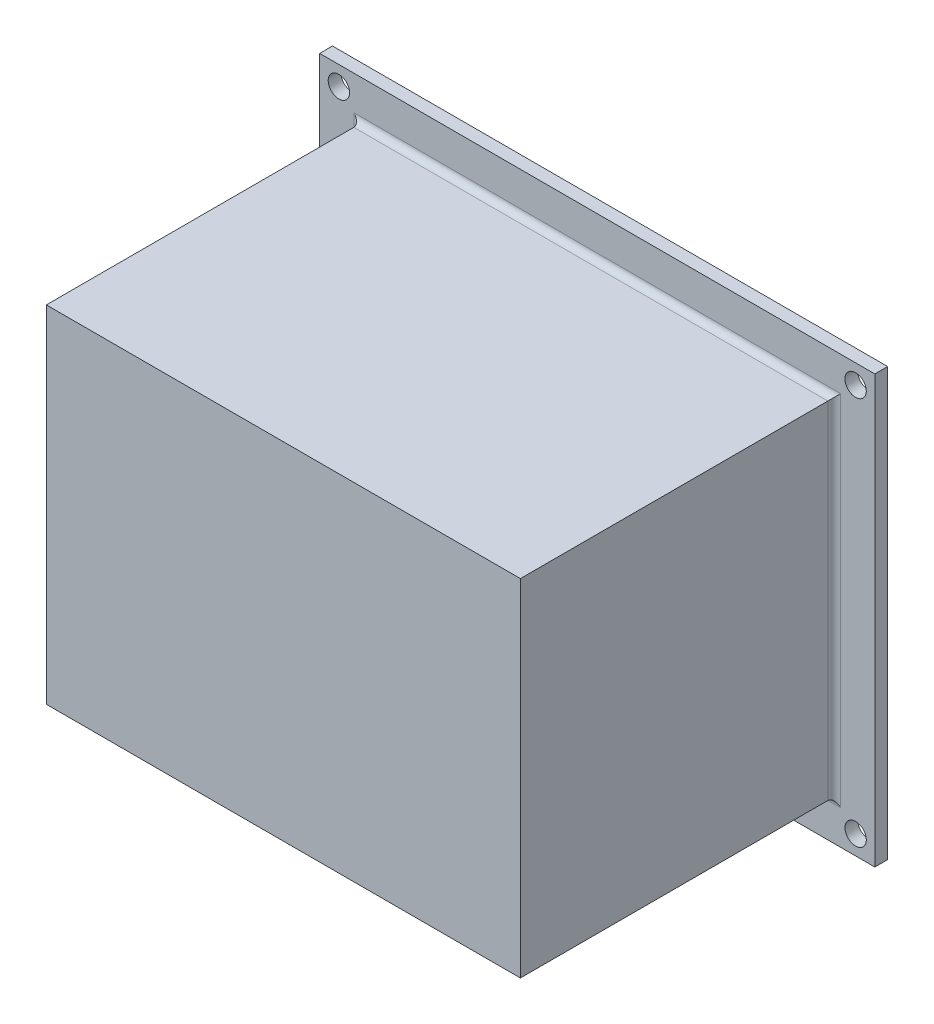
from build123d import *

# Parameters (mm, degrees)
SKETCH_1_W          = 130
SKETCH_1_H          = 100
SKETCH_1_W_2        = 105
SKETCH_1_H_2        = 75
EXTRUDE_1_DEPTH     = 3
SKETCH_2_W          = 111
SKETCH_2_H          = 81
SKETCH_2_W_2        = 105
SKETCH_2_H_2        = 75
EXTRUDE_2_DEPTH     = 73.5
FILLET_1_R          = 1.5
SKETCH_4_R          = 2.5
CUT_EXTRUDE_2_DEPTH = 113.5
CUT_EXTRUDE_4_DEPTH = 73.5
SKETCH_7_W          = 105
SKETCH_7_H          = 75
EXTRUDE_3_DEPTH     = 2.5


with BuildPart() as part:
    # 草图1 → 凸台-拉伸1 (new body)
    with BuildSketch(Plane.XY):
        Rectangle(SKETCH_1_W, SKETCH_1_H)
        Rectangle(SKETCH_1_W_2, SKETCH_1_H_2, mode=Mode.SUBTRACT)
    extrude(amount=EXTRUDE_1_DEPTH)

    # 草图2 → 凸台-拉伸2 (add)
    with BuildSketch(Plane.XY.offset(3)):
        Rectangle(SKETCH_2_W, SKETCH_2_H)
        Rectangle(SKETCH_2_W_2, SKETCH_2_H_2, mode=Mode.SUBTRACT)
    extrude(amount=EXTRUDE_2_DEPTH)

    # 圆角1
    fillet_1_edges = [part.edges().sort_by_distance(p)[0] for p in [
        (55.5, 0, 3),
        (0, 40.5, 3),
        (-55.5, 0, 3),
        (0, -40.5, 3),
    ]]
    fillet(fillet_1_edges, radius=FILLET_1_R)

    # 草图4 → 切除-拉伸2 (cut)
    with BuildSketch(Plane.XY.offset(3)):
        with Locations((-60.5, 45.5)):
            Circle(SKETCH_4_R)
        with Locations((60.5, 45.5)):
            Circle(SKETCH_4_R)
        with Locations((60.5, -45.5)):
            Circle(SKETCH_4_R)
        with Locations((-60.5, -45.5)):
            Circle(SKETCH_4_R)
    extrude(amount=-CUT_EXTRUDE_2_DEPTH, mode=Mode.SUBTRACT)

    # 草图6 → 切除-拉伸4 (cut)
    with BuildSketch(Plane.ZY.offset(55.5)):
        Polygon((25, 0), (47.5, -12.990381057), (47.5, 12.990381057), align=None)
    extrude(amount=-CUT_EXTRUDE_4_DEPTH, mode=Mode.SUBTRACT)

    # 草图7 → 凸台-拉伸3 (add)
    with BuildSketch(Plane.XY.offset(76.5)):
        Rectangle(SKETCH_7_W, SKETCH_7_H)
    extrude(amount=-EXTRUDE_3_DEPTH)


solid = part.part
